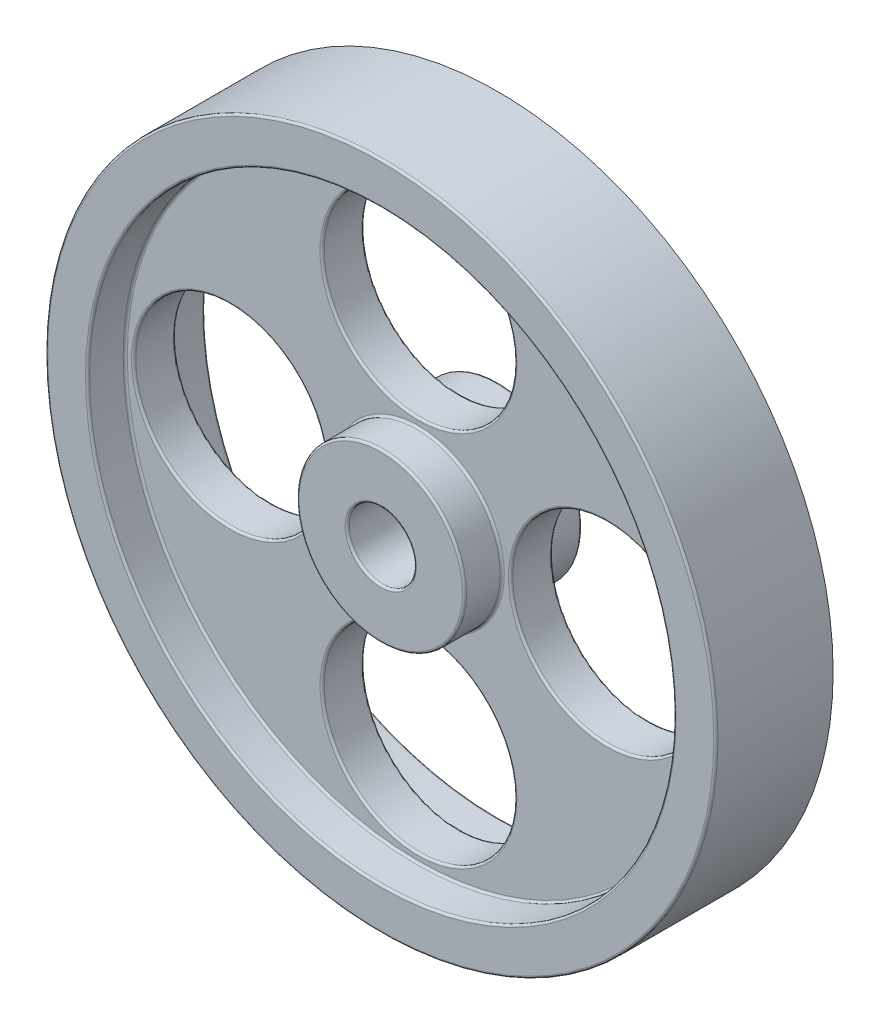
from build123d import *

# Parameters (mm, degrees)
SKETCH1_R               = 1016
SKETCH1_R_2             = 101.6
BOSS_EXTRUDE1_DEPTH     = 177.8
CUT_EXTRUDE1_START      = -114.3
SKETCH2_R               = 889
SKETCH2_R_2             = 101.6
CUT_EXTRUDE1_DEPTH      = 114.3
SKETCH3_R               = 254
SKETCH3_R_2             = 101.6
BOSS_EXTRUDE2_DEPTH     = 114.3
CUT_EXTRUDE2_DEPTH      = 1457.961801146
CUT_EXTRUDE2_DEPTH_BACK = 1457.961801146
SKETCH4_R               = 292.1
FILLET1_R               = 6.35


with BuildPart() as part:
    # Sketch1 → Boss-Extrude1 (new, symmetric)
    with BuildSketch(Plane.XY):
        Circle(SKETCH1_R)
        Circle(SKETCH1_R_2, mode=Mode.SUBTRACT)
    extrude(amount=BOSS_EXTRUDE1_DEPTH, both=True)

    # Sketch2 → Cut-Extrude1 (cut)
    with BuildSketch(Plane.XY.offset(177.8).offset(CUT_EXTRUDE1_START)):
        Circle(SKETCH2_R)
        Circle(SKETCH2_R_2, mode=Mode.SUBTRACT)
    cut_extrude1 = extrude(amount=CUT_EXTRUDE1_DEPTH, mode=Mode.SUBTRACT)

    # Sketch3 → Boss-Extrude2 (add)
    with BuildSketch(Plane.XY.offset(63.5)):
        Circle(SKETCH3_R)
        Circle(SKETCH3_R_2, mode=Mode.SUBTRACT)
    boss_extrude2 = extrude(amount=BOSS_EXTRUDE2_DEPTH)

    # Sketch4 → Cut-Extrude2 (cut, two sides: drawn at the far end of the back side and taken through both)
    with BuildSketch(Plane.XY.offset(63.5).offset(-CUT_EXTRUDE2_DEPTH_BACK)):
        with Locations((0, 571.5)):
            Circle(SKETCH4_R)
        with Locations((571.5, 0)):
            Circle(SKETCH4_R)
        with Locations((0, -571.5)):
            Circle(SKETCH4_R)
        with Locations((-571.5, 0)):
            Circle(SKETCH4_R)
    extrude(amount=CUT_EXTRUDE2_DEPTH + CUT_EXTRUDE2_DEPTH_BACK, mode=Mode.SUBTRACT)

    # Mirror1: Cut-Extrude1 across plane
    add(cut_extrude1.mirror(Plane.XY), mode=Mode.SUBTRACT)

    # Mirror2: Boss-Extrude2 across plane
    add(boss_extrude2.mirror(Plane.XY))

    # Fillet1
    fillet1_edges = [part.edges().sort_by_distance(p)[0] for p in [
        (-889, 0, 63.5),
        (-889, 0, 177.8),
        (-254, 0, 177.8),
        (-254, 0, 63.5),
        (-101.6, 0, 177.8),
        (-292.1, -571.5, 63.5),
        (279.4, 0, 63.5),
        (-863.6, 0, 63.5),
        (-292.1, 571.5, 63.5),
        (-889, 0, -63.5),
        (-292.1, 571.5, -63.5),
        (-863.6, 0, -63.5),
        (279.4, 0, -63.5),
        (-292.1, -571.5, -63.5),
        (-889, 0, -177.8),
        (-1016, 0, 177.8),
        (-254, 0, -63.5),
        (-254, 0, -177.8),
        (-101.6, 0, -177.8),
    ]]
    fillet(fillet1_edges, radius=FILLET1_R)


solid = part.part
